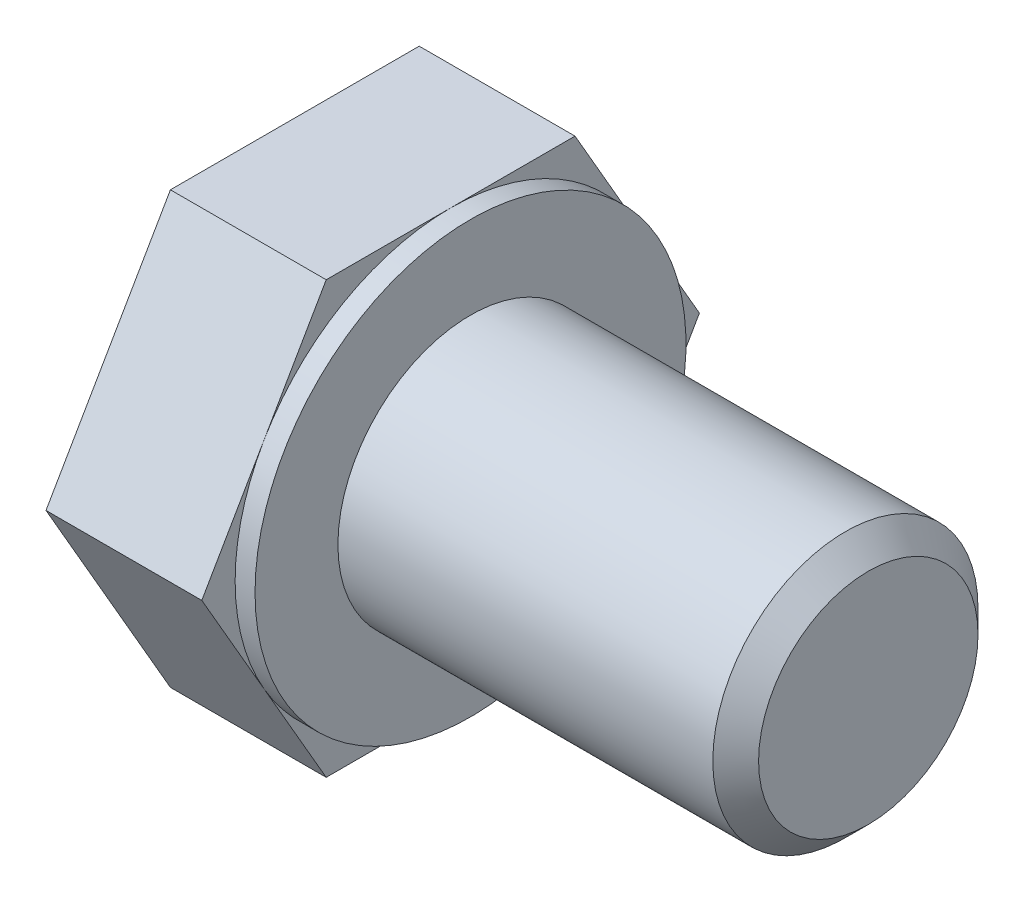
from build123d import *

# Parameters (mm, degrees)
HEX_2_DEPTH = 4.7


with BuildPart() as part:
    # BodySketch → BaseBody (revolve)
    with BuildSketch(Plane(origin=(0, 0, 0), x_dir=(1, 0, 0), z_dir=(0, 1, 0)), mode=Mode.PRIVATE) as basebody_sk:
        Polygon((11.3095, 4), (12, 3.3095), (12, 0), (-0.6, 0), (-0.6, 6.5), (0, 6.5), (0, 4), align=None)
    revolve(basebody_sk.sketch.rotate(Axis((0, 0, 0), (1, 0, 0)), 180), axis=Axis((0, 0, 0), (1, 0, 0)))

    # HeadSketch → Hex 2 (add)
    with BuildSketch(Plane.ZY.offset(0.6)):
        Polygon((7.505553499, 0), (3.75277675, 6.5), (-3.75277675, 6.5), (-7.505553499, 0), (-3.75277675, -6.5), (3.75277675, -6.5), align=None)
    extrude(amount=HEX_2_DEPTH)


solid = part.part
